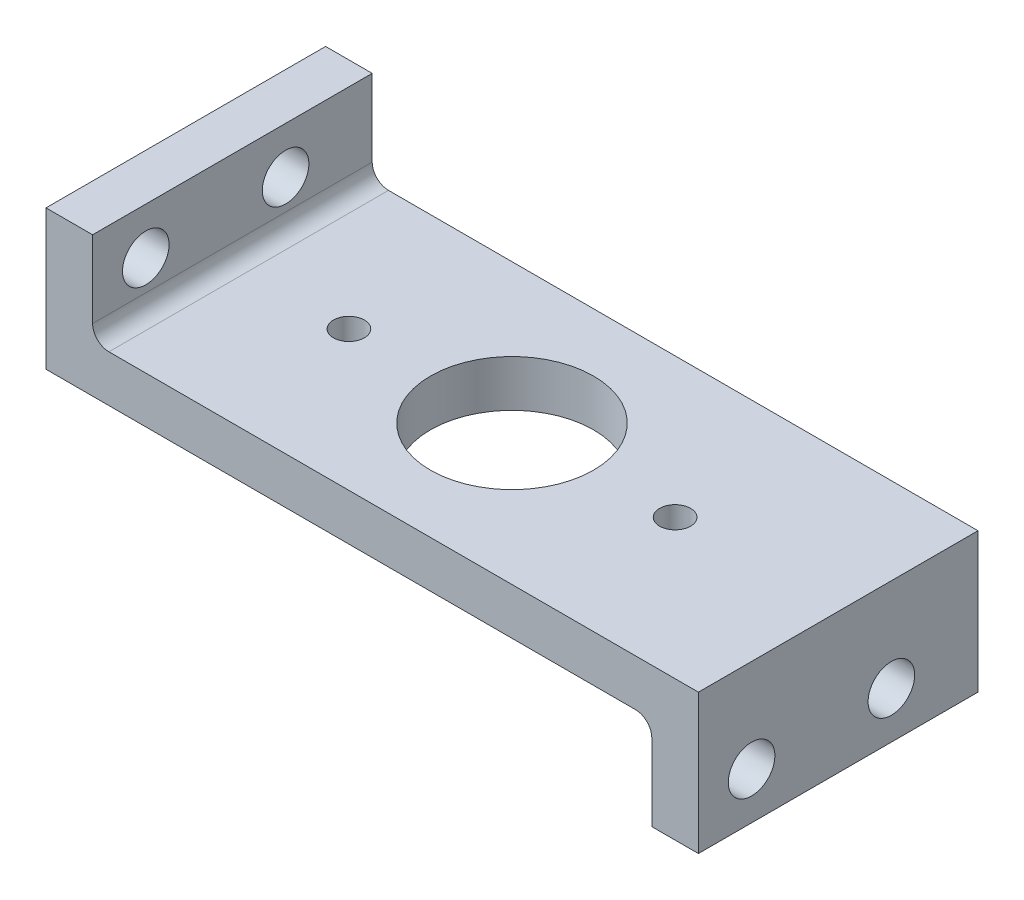
from build123d import *

# Parameters (mm, degrees)
BOSS_EXTRUDE1_DEPTH        = 38.1
F_1_2_0_5_DIAMETER_HOLE1_D = 12.7
SKETCH4_R                  = 22.225
CUT_EXTRUDE1_DEPTH         = 104.953980203
F_3_8_24_TAPPED_HOLE1_D    = 8.4328


with BuildPart() as part:
    # Sketch1 → Boss-Extrude1 (new, symmetric)
    with BuildSketch(Plane.XY):
        with BuildLine():
            Line((-88.9, 31.75), (-88.9, -6.35))
            Line((-88.9, -6.35), (71.755, -6.35))
            ThreePointArc((71.755, -6.35), (74.898089642, -7.651910358), (76.2, -10.795))
            Line((76.2, -10.795), (76.2, -31.75))
            Line((76.2, -31.75), (88.9, -31.75))
            Line((88.9, -31.75), (88.9, 6.35))
            Line((88.9, 6.35), (-71.755, 6.35))
            ThreePointArc((-71.755, 6.35), (-74.898089642, 7.651910358), (-76.2, 10.795))
            Line((-76.2, 10.795), (-76.2, 31.75))
            Line((-76.2, 31.75), (-88.9, 31.75))
        make_face()
    extrude(amount=BOSS_EXTRUDE1_DEPTH, both=True)

    # 1/2 (0.5) Diameter Hole1 (through all)
    with Locations(Plane(origin=(88.9, 0, 0), x_dir=(0, 0, -1), z_dir=(1, 0, 0))):
        with Locations((-23.606482726, -19.05), (14.493517274, -19.05), (-23.606482726, 19.05), (14.493517274, 19.05)):
            Hole(F_1_2_0_5_DIAMETER_HOLE1_D / 2)

    # Sketch4 → Cut-Extrude1 (cut, through all)
    with BuildSketch(Plane(origin=(0, 6.35, 0), x_dir=(1, 0, 0), z_dir=(0, 1, 0))):
        with Locations(Location((0, 0, 0), (0, 0, 180))):
            Circle(SKETCH4_R)
    extrude(amount=-CUT_EXTRUDE1_DEPTH, mode=Mode.SUBTRACT)

    # 3/8-24 Tapped Hole1 (through all)
    with Locations(Plane(origin=(0, 6.35, 0), x_dir=(1, 0, 0), z_dir=(0, 1, 0))):
        with Locations((44.45, 0), (-44.45, 0)):
            Hole(F_3_8_24_TAPPED_HOLE1_D / 2)


solid = part.part
